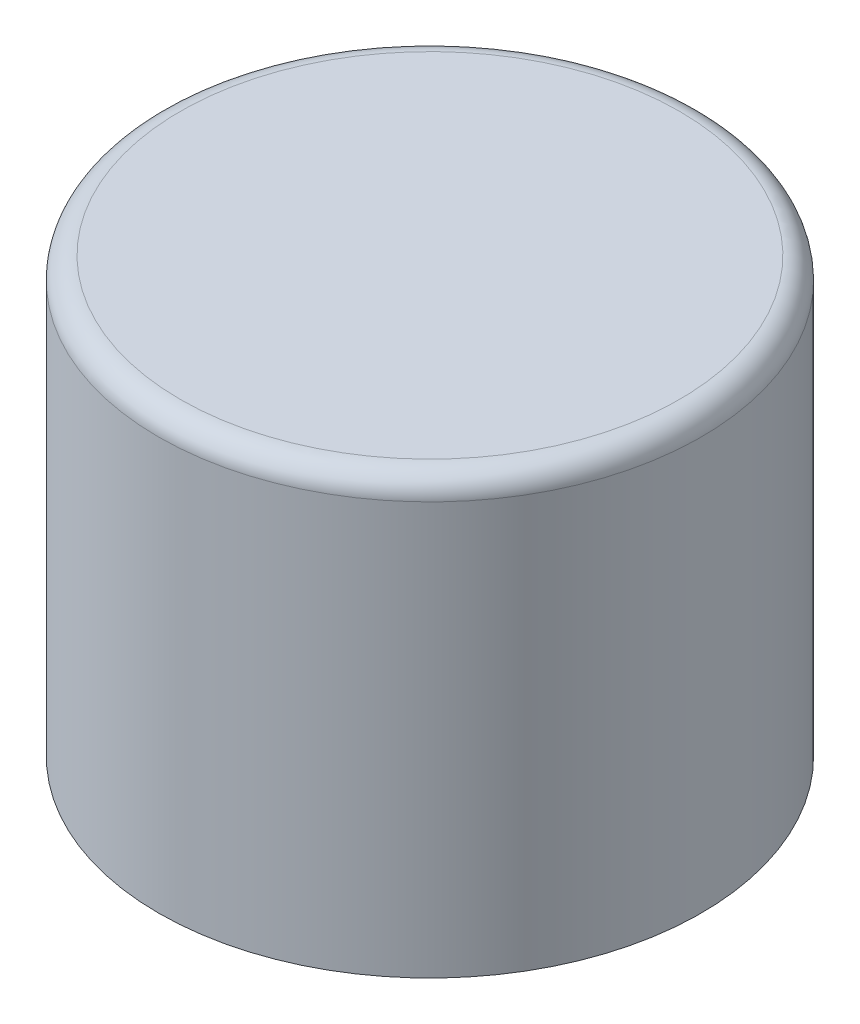
from build123d import *

# Parameters (mm, degrees)
SKETCH2_R           = 31.75
BOSS_EXTRUDE2_DEPTH = 50.8
SHELL1_T            = -3.175
FILLET2_R           = 2.54
CHAMFER1_SIZE       = 2.54


with BuildPart() as part:
    # Sketch2 → Boss-Extrude2 (new body)
    with BuildSketch(Plane(origin=(0, 0, 0), x_dir=(1, 0, 0), z_dir=(0, 1, 0))):
        with Locations(Location((0, 0, 0), (0, 0, 270))):
            Circle(SKETCH2_R)
    extrude(amount=BOSS_EXTRUDE2_DEPTH)

    # Shell1
    shell1_openings = [part.faces().sort_by_distance(p)[0] for p in [
        (0, 0, 0),
    ]]
    offset(amount=SHELL1_T, openings=shell1_openings, kind=Kind.INTERSECTION)

    # Fillet2
    fillet2_edges = [part.edges().sort_by_distance(p)[0] for p in [
        (0, 50.8, -31.75),
    ]]
    fillet(fillet2_edges, radius=FILLET2_R)

    # Chamfer1
    chamfer1_edges = [part.edges().sort_by_distance(p)[0] for p in [
        (0, 0, -28.575),
    ]]
    chamfer(chamfer1_edges, length=CHAMFER1_SIZE)


solid = part.part
